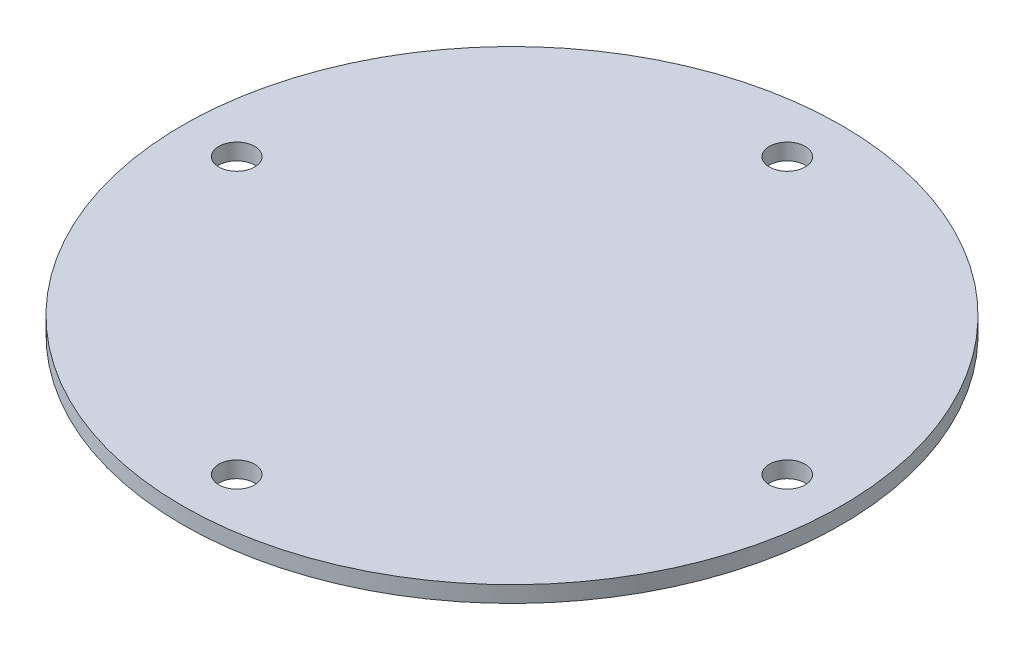
from build123d import *

# Parameters (mm, degrees)
SKETCH1_R            = 60.7
BOSS_EXTRUDE1_DEPTH  = 1.5
M6_CLEARANCE_HOLE1_D = 6.6
CIRPATTERN2_COUNT    = 4


with BuildPart() as part:
    # Sketch1 → Boss-Extrude1 (new, symmetric)
    with BuildSketch(Plane(origin=(0, 0, 0), x_dir=(1, 0, 0), z_dir=(0, 1, 0))):
        with Locations(Location((0, 0, 0), (0, 0, 270))):
            Circle(SKETCH1_R)
    extrude(amount=BOSS_EXTRUDE1_DEPTH, both=True)

    # M6 Clearance Hole1 (through all)
    with Locations(Plane(origin=(0, 1.5, 0), x_dir=(1, 0, 0), z_dir=(0, 1, 0))):
        with Locations((50.7, 0)):
            m6_clearance_hole1 = Hole(M6_CLEARANCE_HOLE1_D / 2)

    # CirPattern2: M6 Clearance Hole1 ×4 about axis
    cirpattern2_axis = Axis((0, 0, 0), (0, 1, 0))
    for i in range(1, CIRPATTERN2_COUNT):
        add(m6_clearance_hole1.rotate(cirpattern2_axis, i * 360 / CIRPATTERN2_COUNT), mode=Mode.SUBTRACT)


solid = part.part
